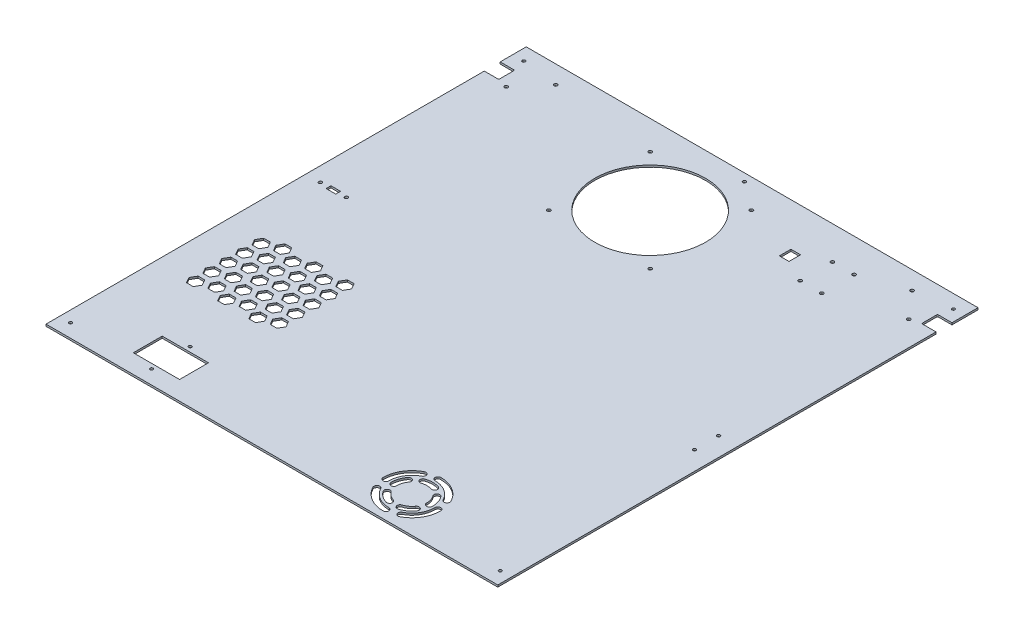
from build123d import *

# Parameters (mm, degrees)
CROQUIS1_W              = 470.5
CROQUIS1_H              = 420
SALIENTE_EXTRUIR1_DEPTH = 2
CROQUIS2_R              = 1.55
CORTAR_EXTRUIR1_DEPTH   = 2
CROQUIS3_W              = 470.5
CROQUIS3_H              = 420
CROQUIS3_W_2            = 469.5
CROQUIS3_H_2            = 419
CORTAR_EXTRUIR2_DEPTH   = 2
CORTAR_EXTRUIR3_DEPTH   = 2
CROQUIS5_R              = 1.55
CROQUIS5_W              = 48
CROQUIS5_H              = 30
CORTAR_EXTRUIR4_DEPTH   = 2
CROQUIS8_W              = 469.5
CROQUIS8_H              = 30
SALIENTE_EXTRUIR2_DEPTH = 2
CROQUIS10_R             = 1.75
SALIENTE_EXTRUIR3_DEPTH = 2
CROQUIS11_W             = 469.5
CROQUIS11_H             = 2
SALIENTE_EXTRUIR4_DEPTH = 50
CROQUIS12_R             = 1.55
CORTAR_EXTRUIR8_DEPTH   = 2
CROQUIS13_R             = 1.75
CROQUIS13_W             = 10
CROQUIS13_H             = 12
CORTAR_EXTRUIR9_DEPTH   = 2
CROQUIS15_R             = 1.6
CORTAR_EXTRUIR11_DEPTH  = 2
CROQUIS16_W             = 469.5
CROQUIS16_H             = 499
CROQUIS16_W_2           = 468.5
CROQUIS16_H_2           = 498
CORTAR_EXTRUIR12_DEPTH  = 2
CROQUIS17_R             = 1.6
CORTAR_EXTRUIR13_DEPTH  = 2
CROQUIS18_R             = 1.65
CROQUIS18_W             = 10
CROQUIS18_H             = 5
CORTAR_EXTRUIR14_DEPTH  = 2
CORTAR_EXTRUIR15_DEPTH  = 2
CROQUIS20_R             = 1.75
CROQUIS20_R_2           = 57.5
CORTAR_EXTRUIR16_DEPTH  = 2
CROQUIS21_R             = 1.75
CORTAR_EXTRUIR17_DEPTH  = 2
CROQUIS22_W             = 15
CROQUIS22_H             = 16.5
CORTAR_EXTRUIR18_DEPTH  = 2
REDONDEO1_R             = 1


with BuildPart() as part:
    # Croquis1 → Saliente-Extruir1 (new body)
    with BuildSketch(Plane(origin=(0, 0, 0), x_dir=(1, 0, 0), z_dir=(0, 1, 0))):
        with Locations((235.25, 210)):
            Rectangle(CROQUIS1_W, CROQUIS1_H)
    extrude(amount=SALIENTE_EXTRUIR1_DEPTH)

    # Croquis2 → Cortar-Extruir1 (cut)
    with BuildSketch(Plane(origin=(0, 2, 0), x_dir=(1, 0, 0), z_dir=(0, 1, 0))):
        with Locations(Location((12.5, 405, 0), (0, 0, 270))):
            Circle(CROQUIS2_R)
        with Locations(Location((458, 405, 0), (0, 0, 270))):
            Circle(CROQUIS2_R)
        with Locations(Location((458, 15, 0), (0, 0, 270))):
            Circle(CROQUIS2_R)
        with Locations(Location((12.5, 15, 0), (0, 0, 270))):
            Circle(CROQUIS2_R)
    extrude(amount=-CORTAR_EXTRUIR1_DEPTH, mode=Mode.SUBTRACT)

    # Croquis3 → Cortar-Extruir2 (cut)
    with BuildSketch(Plane(origin=(0, 2, 0), x_dir=(1, 0, 0), z_dir=(0, 1, 0))):
        with Locations((235.25, 210)):
            Rectangle(CROQUIS3_W, CROQUIS3_H)
        with Locations((235.25, 210)):
            Rectangle(CROQUIS3_W_2, CROQUIS3_H_2, mode=Mode.SUBTRACT)
    extrude(amount=-CORTAR_EXTRUIR2_DEPTH, mode=Mode.SUBTRACT)

    # Croquis4 → Cortar-Extruir3 (cut)
    with BuildSketch(Plane(origin=(0, 2, 0), x_dir=(1, 0, 0), z_dir=(0, 1, 0))):
        with BuildLine():
            ThreePointArc((370.102065733, 51.868312757), (359.055555556, 63.651991957), (343.5, 68))
            ThreePointArc((343.5, 68), (340.5, 65), (343.5, 62))
            ThreePointArc((343.5, 62), (355.944444444, 58.521593566), (364.781652586, 49.094650206))
            ThreePointArc((364.781652586, 49.094650206), (368.828690436, 47.821274908), (370.102065733, 51.868312757))
        make_face()
        with BuildLine():
            ThreePointArc((354.594650206, 16.718347414), (364.021593566, 25.555555556), (367.5, 38))
            ThreePointArc((367.5, 38), (370.5, 41), (373.5, 38))
            ThreePointArc((373.5, 38), (369.151991957, 22.444444444), (357.368312757, 11.397934267))
            ThreePointArc((357.368312757, 11.397934267), (353.321274908, 12.671309564), (354.594650206, 16.718347414))
        make_face()
        with BuildLine():
            ThreePointArc((322.218347414, 26.905349794), (331.055555556, 17.478406434), (343.5, 14))
            ThreePointArc((343.5, 14), (346.5, 11), (343.5, 8))
            ThreePointArc((343.5, 8), (327.944444444, 12.348008043), (316.897934267, 24.131687243))
            ThreePointArc((316.897934267, 24.131687243), (318.171309564, 28.178725092), (322.218347414, 26.905349794))
        make_face()
        with BuildLine():
            ThreePointArc((332.405349794, 59.281652586), (322.978406434, 50.444444444), (319.5, 38))
            ThreePointArc((319.5, 38), (316.5, 35), (313.5, 38))
            ThreePointArc((313.5, 38), (317.848008043, 53.555555556), (329.631687243, 64.602065733))
            ThreePointArc((329.631687243, 64.602065733), (333.678725092, 63.328690436), (332.405349794, 59.281652586))
        make_face()
        with BuildLine():
            ThreePointArc((350.472972973, 58.337837838), (343.5, 59.5), (336.527027027, 58.337837838))
            ThreePointArc((336.527027027, 58.337837838), (334.662162162, 54.527027027), (338.472972973, 52.662162162))
            ThreePointArc((338.472972973, 52.662162162), (343.5, 53.5), (348.527027027, 52.662162162))
            ThreePointArc((348.527027027, 52.662162162), (352.337837838, 54.527027027), (350.472972973, 58.337837838))
        make_face()
        with BuildLine():
            ThreePointArc((364.997200353, 37.653046137), (363.9477151, 44.643865379), (360.687666053, 50.916428905))
            ThreePointArc((360.687666053, 50.916428905), (356.487094664, 51.512415483), (355.891108085, 47.311844094))
            ThreePointArc((355.891108085, 47.311844094), (358.241376003, 42.789763413), (358.99798165, 37.749870471))
            ThreePointArc((358.99798165, 37.749870471), (361.949178834, 34.701848952), (364.997200353, 37.653046137))
        make_face()
        with BuildLine():
            ThreePointArc((349.813027508, 17.447732882), (356.137382924, 20.606134621), (361.095534781, 25.644954238))
            ThreePointArc((361.095534781, 25.644954238), (360.364303755, 29.824105012), (356.185152982, 29.092873986))
            ThreePointArc((356.185152982, 29.092873986), (352.610671411, 25.460236587), (348.05125239, 23.183249287))
            ThreePointArc((348.05125239, 23.183249287), (346.064381746, 19.434603525), (349.813027508, 17.447732882))
        make_face()
        with BuildLine():
            ThreePointArc((325.904465219, 25.644954238), (330.862617076, 20.606134621), (337.186972492, 17.447732882))
            ThreePointArc((337.186972492, 17.447732882), (340.935618254, 19.434603525), (338.94874761, 23.183249287))
            ThreePointArc((338.94874761, 23.183249287), (334.389328589, 25.460236587), (330.814847018, 29.092873986))
            ThreePointArc((330.814847018, 29.092873986), (326.635696245, 29.824105012), (325.904465219, 25.644954238))
        make_face()
        with BuildLine():
            ThreePointArc((326.312333947, 50.916428905), (323.0522849, 44.643865379), (322.002799647, 37.653046137))
            ThreePointArc((322.002799647, 37.653046137), (325.050821166, 34.701848952), (328.00201835, 37.749870471))
            ThreePointArc((328.00201835, 37.749870471), (328.758623997, 42.789763413), (331.108891915, 47.311844094))
            ThreePointArc((331.108891915, 47.311844094), (330.512905336, 51.512415483), (326.312333947, 50.916428905))
        make_face()
    extrude(amount=-CORTAR_EXTRUIR3_DEPTH, mode=Mode.SUBTRACT)

    # Croquis5 → Cortar-Extruir4 (cut)
    with BuildSketch(Plane.XZ):
        with Locations(Location((96, -15.5, 0), (0, 0, 270))):
            Circle(CROQUIS5_R)
        with Locations(Location((96, -55.5, 0), (0, 0, 270))):
            Circle(CROQUIS5_R)
        with Locations((96, -35.5)):
            Rectangle(CROQUIS5_W, CROQUIS5_H)
    extrude(amount=-CORTAR_EXTRUIR4_DEPTH, mode=Mode.SUBTRACT)

    # Croquis8 → Saliente-Extruir2 (add)
    with BuildSketch(Plane.XZ):
        with Locations((235.25, -434.5)):
            Rectangle(CROQUIS8_W, CROQUIS8_H)
    extrude(amount=-SALIENTE_EXTRUIR2_DEPTH)

    # Croquis10 → Saliente-Extruir3 (add)
    with BuildSketch(Plane.XZ):
        with Locations((458, -405)):
            Circle(CROQUIS10_R)
        with Locations((12.5, -405)):
            Circle(CROQUIS10_R)
    extrude(amount=-SALIENTE_EXTRUIR3_DEPTH)

    # Croquis11 → Saliente-Extruir4 (add)
    with BuildSketch(Plane(origin=(0, 0, -449.5), x_dir=(-1, 0, 0), z_dir=(0, 0, -1))):
        with Locations((-235.25, 1)):
            Rectangle(CROQUIS11_W, CROQUIS11_H)
    extrude(amount=SALIENTE_EXTRUIR4_DEPTH)

    # Croquis12 → Cortar-Extruir8 (cut)
    with BuildSketch(Plane.XZ):
        with Locations(Location((458, -485, 0), (0, 0, 270))):
            Circle(CROQUIS12_R)
        with Locations(Location((12.5, -485, 0), (0, 0, 270))):
            Circle(CROQUIS12_R)
    extrude(amount=-CORTAR_EXTRUIR8_DEPTH, mode=Mode.SUBTRACT)

    # Croquis13 → Cortar-Extruir9 (cut)
    with BuildSketch(Plane.XZ):
        with Locations(Location((353, -464.5, 0), (0, 0, 270))):
            Circle(CROQUIS13_R)
        with Locations(Location((353, -431, 0), (0, 0, 270))):
            Circle(CROQUIS13_R)
        with Locations(Location((375.5, -464.5, 0), (0, 0, 270))):
            Circle(CROQUIS13_R)
        with Locations(Location((375.5, -431, 0), (0, 0, 270))):
            Circle(CROQUIS13_R)
        with Locations((325, -448.5)):
            Rectangle(CROQUIS13_W, CROQUIS13_H)
    extrude(amount=-CORTAR_EXTRUIR9_DEPTH, mode=Mode.SUBTRACT)

    # Croquis15 → Cortar-Extruir11 (cut)
    with BuildSketch(Plane.XZ):
        with Locations(Location((450, -249.5, 0), (0, 0, 270))):
            Circle(CROQUIS15_R)
        with Locations(Location((450, -224.5, 0), (0, 0, 270))):
            Circle(CROQUIS15_R)
    extrude(amount=-CORTAR_EXTRUIR11_DEPTH, mode=Mode.SUBTRACT)

    # Croquis16 → Cortar-Extruir12 (cut)
    with BuildSketch(Plane.XZ):
        with Locations((235.25, -250)):
            Rectangle(CROQUIS16_W, CROQUIS16_H)
        with Locations((235.25, -250)):
            Rectangle(CROQUIS16_W_2, CROQUIS16_H_2, mode=Mode.SUBTRACT)
    extrude(amount=-CORTAR_EXTRUIR12_DEPTH, mode=Mode.SUBTRACT)

    # Croquis17 → Cortar-Extruir13 (cut)
    with BuildSketch(Plane(origin=(0, 2, 0), x_dir=(1, 0, 0), z_dir=(0, 1, 0))):
        with Locations(Location((235.25, 491, 0), (0, 0, 270))):
            Circle(CROQUIS17_R)
    extrude(amount=-CORTAR_EXTRUIR13_DEPTH, mode=Mode.SUBTRACT)

    # Croquis18 → Cortar-Extruir14 (cut)
    with BuildSketch(Plane.XZ):
        with Locations(Location((16, -270.5, 0), (0, 0, 270))):
            Circle(CROQUIS18_R)
        with Locations(Location((43, -270.5, 0), (0, 0, 270))):
            Circle(CROQUIS18_R)
        with Locations((29.5, -270.5)):
            Rectangle(CROQUIS18_W, CROQUIS18_H)
    extrude(amount=-CORTAR_EXTRUIR14_DEPTH, mode=Mode.SUBTRACT)

    # Croquis19 → Cortar-Extruir15 (cut)
    with BuildSketch(Plane.XZ):
        Polygon((114.07179677, -191), (117.535898385, -197), (124.464101615, -197), (127.92820323, -191), (124.464101615, -185), (117.535898385, -185), align=None)
        Polygon((114.07179677, -174), (117.535898385, -180), (124.464101615, -180), (127.92820323, -174), (124.464101615, -168), (117.535898385, -168), align=None)
        Polygon((97.905989232, -185), (101.370090848, -191), (108.298294078, -191), (111.762395693, -185), (108.298294078, -179), (101.370090848, -179), align=None)
        Polygon((97.905989232, -168), (101.370090848, -174), (108.298294078, -174), (111.762395693, -168), (108.298294078, -162), (101.370090848, -162), align=None)
        Polygon((114.07179677, -157), (117.535898385, -163), (124.464101615, -163), (127.92820323, -157), (124.464101615, -151), (117.535898385, -151), align=None)
        Polygon((97.905989232, -151), (101.370090848, -157), (108.298294078, -157), (111.762395693, -151), (108.298294078, -145), (101.370090848, -145), align=None)
        Polygon((114.07179677, -140), (117.535898385, -146), (124.464101615, -146), (127.92820323, -140), (124.464101615, -134), (117.535898385, -134), align=None)
        Polygon((97.905989232, -134), (101.370090848, -140), (108.298294078, -140), (111.762395693, -134), (108.298294078, -128), (101.370090848, -128), align=None)
        Polygon((114.07179677, -123), (117.535898385, -129), (124.464101615, -129), (127.92820323, -123), (124.464101615, -117), (117.535898385, -117), align=None)
        Polygon((97.905989232, -117), (101.370090848, -123), (108.298294078, -123), (111.762395693, -117), (108.298294078, -111), (101.370090848, -111), align=None)
        Polygon((81.740181695, -191), (85.20428331, -197), (92.132486541, -197), (95.596588156, -191), (92.132486541, -185), (85.20428331, -185), align=None)
        Polygon((81.740181695, -174), (85.20428331, -180), (92.132486541, -180), (95.596588156, -174), (92.132486541, -168), (85.20428331, -168), align=None)
        Polygon((65.574374158, -185), (69.038475773, -191), (75.966679003, -191), (79.430780618, -185), (75.966679003, -179), (69.038475773, -179), align=None)
        Polygon((65.574374158, -168), (69.038475773, -174), (75.966679003, -174), (79.430780618, -168), (75.966679003, -162), (69.038475773, -162), align=None)
        Polygon((81.740181695, -157), (85.20428331, -163), (92.132486541, -163), (95.596588156, -157), (92.132486541, -151), (85.20428331, -151), align=None)
        Polygon((65.574374158, -151), (69.038475773, -157), (75.966679003, -157), (79.430780618, -151), (75.966679003, -145), (69.038475773, -145), align=None)
        Polygon((81.740181695, -140), (85.20428331, -146), (92.132486541, -146), (95.596588156, -140), (92.132486541, -134), (85.20428331, -134), align=None)
        Polygon((65.574374158, -134), (69.038475773, -140), (75.966679003, -140), (79.430780618, -134), (75.966679003, -128), (69.038475773, -128), align=None)
        Polygon((81.740181695, -123), (85.20428331, -129), (92.132486541, -129), (95.596588156, -123), (92.132486541, -117), (85.20428331, -117), align=None)
        Polygon((65.574374158, -117), (69.038475773, -123), (75.966679003, -123), (79.430780618, -117), (75.966679003, -111), (69.038475773, -111), align=None)
        Polygon((49.40856662, -191), (52.872668236, -197), (59.800871466, -197), (63.264973081, -191), (59.800871466, -185), (52.872668236, -185), align=None)
        Polygon((49.40856662, -174), (52.872668236, -180), (59.800871466, -180), (63.264973081, -174), (59.800871466, -168), (52.872668236, -168), align=None)
        Polygon((33.242759083, -185), (36.706860698, -191), (43.635063929, -191), (47.099165544, -185), (43.635063929, -179), (36.706860698, -179), align=None)
        Polygon((33.242759083, -168), (36.706860698, -174), (43.635063929, -174), (47.099165544, -168), (43.635063929, -162), (36.706860698, -162), align=None)
        Polygon((49.40856662, -157), (52.872668236, -163), (59.800871466, -163), (63.264973081, -157), (59.800871466, -151), (52.872668236, -151), align=None)
        Polygon((33.242759083, -151), (36.706860698, -157), (43.635063929, -157), (47.099165544, -151), (43.635063929, -145), (36.706860698, -145), align=None)
        Polygon((49.40856662, -140), (52.872668236, -146), (59.800871466, -146), (63.264973081, -140), (59.800871466, -134), (52.872668236, -134), align=None)
        Polygon((33.242759083, -134), (36.706860698, -140), (43.635063929, -140), (47.099165544, -134), (43.635063929, -128), (36.706860698, -128), align=None)
        Polygon((49.40856662, -123), (52.872668236, -129), (59.800871466, -129), (63.264973081, -123), (59.800871466, -117), (52.872668236, -117), align=None)
        Polygon((33.242759083, -117), (36.706860698, -123), (43.635063929, -123), (47.099165544, -117), (43.635063929, -111), (36.706860698, -111), align=None)
    extrude(amount=-CORTAR_EXTRUIR15_DEPTH, mode=Mode.SUBTRACT)

    # Croquis20 → Cortar-Extruir16 (cut)
    with BuildSketch(Plane.XZ):
        with Locations(Location((264.5, -469, 0), (0, 0, 270))):
            Circle(CROQUIS20_R)
        with Locations(Location((159.5, -469, 0), (0, 0, 270))):
            Circle(CROQUIS20_R)
        with Locations(Location((159.5, -364, 0), (0, 0, 270))):
            Circle(CROQUIS20_R)
        with Locations(Location((264.5, -364, 0), (0, 0, 270))):
            Circle(CROQUIS20_R)
        with Locations(Location((212, -416.5, 0), (0, 0, 270))):
            Circle(CROQUIS20_R_2)
    extrude(amount=-CORTAR_EXTRUIR16_DEPTH, mode=Mode.SUBTRACT)

    # Croquis21 → Cortar-Extruir17 (cut)
    with BuildSketch(Plane.XZ):
        with Locations(Location((444, -452.66, 0), (0, 0, 270))):
            Circle(CROQUIS21_R)
        with Locations(Location((420, -480.16, 0), (0, 0, 270))):
            Circle(CROQUIS21_R)
        with Locations(Location((26.5, -452.66, 0), (0, 0, 270))):
            Circle(CROQUIS21_R)
        with Locations(Location((50.5, -480.16, 0), (0, 0, 270))):
            Circle(CROQUIS21_R)
    extrude(amount=-CORTAR_EXTRUIR17_DEPTH, mode=Mode.SUBTRACT)

    # Croquis22 → Cortar-Extruir18 (cut)
    with BuildSketch(Plane.XZ):
        with Locations((462, -463.75)):
            Rectangle(CROQUIS22_W, CROQUIS22_H)
        with Locations((8.5, -463.75)):
            Rectangle(CROQUIS22_W, CROQUIS22_H)
    extrude(amount=-CORTAR_EXTRUIR18_DEPTH, mode=Mode.SUBTRACT)

    # Redondeo1
    redondeo1_edges = [part.edges().sort_by_distance(p)[0] for p in [
        (454.5, 1, -472),
        (454.5, 1, -455.5),
        (16, 1, -472),
        (16, 1, -455.5),
    ]]
    fillet(redondeo1_edges, radius=REDONDEO1_R)


solid = part.part
